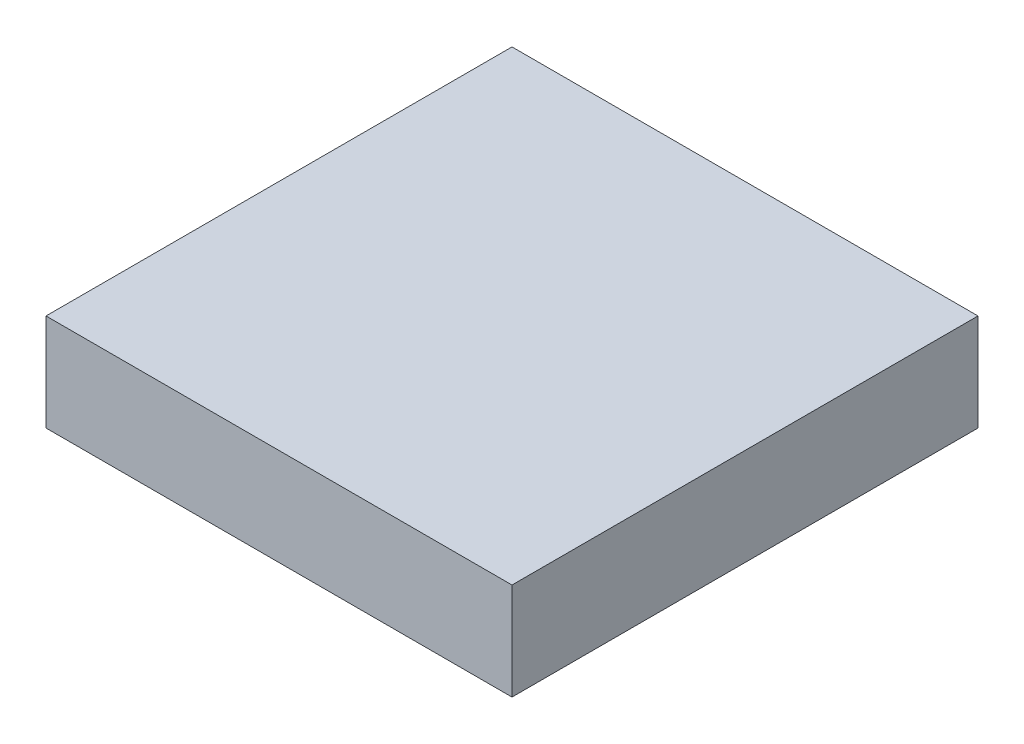
from build123d import *

# Parameters (mm, degrees)
BOSS_EXTRUDE1_DEPTH = 25


with BuildPart() as part:
    # Sketch1 → Boss-Extrude1 (new body)
    with BuildSketch(Plane(origin=(0, 0, 0), x_dir=(1, 0, 0), z_dir=(0, 1, 0))):
        Polygon((-60, -60), (-22.593310132, -60), (32.177273624, -60), (60, -60), (60, 60), (-60, 60), align=None)
    extrude(amount=BOSS_EXTRUDE1_DEPTH)


solid = part.part
